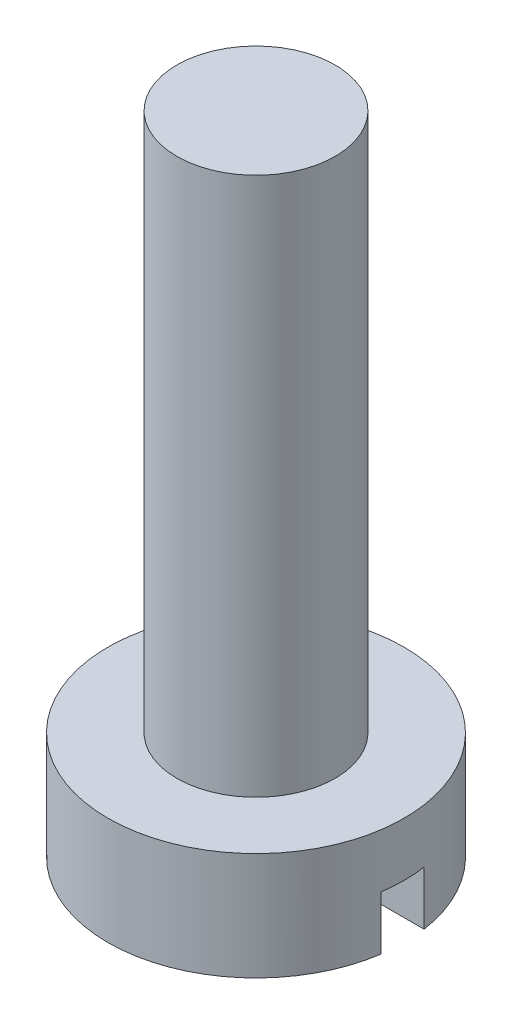
from build123d import *

# Parameters (mm, degrees)
BOSS_EXTRUDE1_DEPTH = 2
CUT_EXTRUDE1_DEPTH  = 1
BOSS_EXTRUDE2_START = 2
BOSS_EXTRUDE2_DEPTH = 10


with BuildPart() as part:
    # Sketch1 → Boss-Extrude1 (new body)
    with BuildSketch(Plane(origin=(0, 0, 0), x_dir=(1, 0, 0), z_dir=(0, 1, 0))):
        with BuildLine():
            ThreePointArc((-1.414531725, 0.4), (0, 1.47), (1.414531725, 0.4))
            Line((1.414531725, 0.4), (2.720753572, 0.4))
            ThreePointArc((2.720753572, 0.4), (0, 2.75), (-2.720753572, 0.4))
            Line((-2.720753572, 0.4), (-1.414531725, 0.4))
        make_face()
        with BuildLine():
            Line((-1.414531725, 0.4), (0, 0.4))
            Line((0, 0.4), (1.414531725, 0.4))
            ThreePointArc((1.414531725, 0.4), (0, 1.47), (-1.414531725, 0.4))
        make_face()
        with BuildLine():
            Line((1.414531725, 0.4), (0, 0.4))
            Line((0, 0.4), (-1.414531725, 0.4))
            ThreePointArc((-1.414531725, 0.4), (-1.47, 0), (-1.414531725, -0.4))
            Line((-1.414531725, -0.4), (1.414531725, -0.4))
            ThreePointArc((1.414531725, -0.4), (1.4560669, -0.201913799), (1.47, 0))
            ThreePointArc((1.47, 0), (1.4560669, 0.201913799), (1.414531725, 0.4))
        make_face()
        with BuildLine():
            Line((1.414531725, -0.4), (-1.414531725, -0.4))
            ThreePointArc((-1.414531725, -0.4), (0, -1.47), (1.414531725, -0.4))
        make_face()
        with BuildLine():
            ThreePointArc((1.414531725, -0.4), (0, -1.47), (-1.414531725, -0.4))
            Line((-1.414531725, -0.4), (-2.720753572, -0.4))
            ThreePointArc((-2.720753572, -0.4), (0, -2.75), (2.720753572, -0.4))
            Line((2.720753572, -0.4), (1.414531725, -0.4))
        make_face()
        with BuildLine():
            Line((2.720753572, 0.4), (1.414531725, 0.4))
            ThreePointArc((1.414531725, 0.4), (1.4560669, 0.201913799), (1.47, 0))
            ThreePointArc((1.47, 0), (1.4560669, -0.201913799), (1.414531725, -0.4))
            Line((1.414531725, -0.4), (2.720753572, -0.4))
            ThreePointArc((2.720753572, -0.4), (2.742678647, -0.200533883), (2.75, 0))
            ThreePointArc((2.75, 0), (2.742678647, 0.200533883), (2.720753572, 0.4))
        make_face()
        with BuildLine():
            ThreePointArc((-1.414531725, -0.4), (-1.47, 0), (-1.414531725, 0.4))
            Line((-1.414531725, 0.4), (-2.720753572, 0.4))
            ThreePointArc((-2.720753572, 0.4), (-2.75, 0), (-2.720753572, -0.4))
            Line((-2.720753572, -0.4), (-1.414531725, -0.4))
        make_face()
    extrude(amount=BOSS_EXTRUDE1_DEPTH)

    # Sketch1<3> → Cut-Extrude1 (cut)
    with BuildSketch(Plane(origin=(0, 0, 0), x_dir=(1, 0, 0), z_dir=(0, 1, 0))):
        with BuildLine():
            Line((2.720753572, 0.4), (1.414531725, 0.4))
            ThreePointArc((1.414531725, 0.4), (1.4560669, 0.201913799), (1.47, 0))
            ThreePointArc((1.47, 0), (1.4560669, -0.201913799), (1.414531725, -0.4))
            Line((1.414531725, -0.4), (2.720753572, -0.4))
            ThreePointArc((2.720753572, -0.4), (2.742678647, -0.200533883), (2.75, 0))
            ThreePointArc((2.75, 0), (2.742678647, 0.200533883), (2.720753572, 0.4))
        make_face()
        with BuildLine():
            ThreePointArc((-1.414531725, -0.4), (-1.47, 0), (-1.414531725, 0.4))
            Line((-1.414531725, 0.4), (-2.720753572, 0.4))
            ThreePointArc((-2.720753572, 0.4), (-2.75, 0), (-2.720753572, -0.4))
            Line((-2.720753572, -0.4), (-1.414531725, -0.4))
        make_face()
        with BuildLine():
            Line((1.414531725, 0.4), (0, 0.4))
            Line((0, 0.4), (-1.414531725, 0.4))
            ThreePointArc((-1.414531725, 0.4), (-1.47, 0), (-1.414531725, -0.4))
            Line((-1.414531725, -0.4), (1.414531725, -0.4))
            ThreePointArc((1.414531725, -0.4), (1.4560669, -0.201913799), (1.47, 0))
            ThreePointArc((1.47, 0), (1.4560669, 0.201913799), (1.414531725, 0.4))
        make_face()
    extrude(amount=CUT_EXTRUDE1_DEPTH, mode=Mode.SUBTRACT)

    # Sketch1<4> → Boss-Extrude2 (add)
    with BuildSketch(Plane(origin=(0, 0, 0), x_dir=(1, 0, 0), z_dir=(0, 1, 0)).offset(BOSS_EXTRUDE2_START)):
        with BuildLine():
            Line((-1.414531725, 0.4), (0, 0.4))
            Line((0, 0.4), (1.414531725, 0.4))
            ThreePointArc((1.414531725, 0.4), (0, 1.47), (-1.414531725, 0.4))
        make_face()
        with BuildLine():
            Line((1.414531725, 0.4), (0, 0.4))
            Line((0, 0.4), (-1.414531725, 0.4))
            ThreePointArc((-1.414531725, 0.4), (-1.47, 0), (-1.414531725, -0.4))
            Line((-1.414531725, -0.4), (1.414531725, -0.4))
            ThreePointArc((1.414531725, -0.4), (1.4560669, -0.201913799), (1.47, 0))
            ThreePointArc((1.47, 0), (1.4560669, 0.201913799), (1.414531725, 0.4))
        make_face()
        with BuildLine():
            Line((1.414531725, -0.4), (-1.414531725, -0.4))
            ThreePointArc((-1.414531725, -0.4), (0, -1.47), (1.414531725, -0.4))
        make_face()
    extrude(amount=BOSS_EXTRUDE2_DEPTH)


solid = part.part
